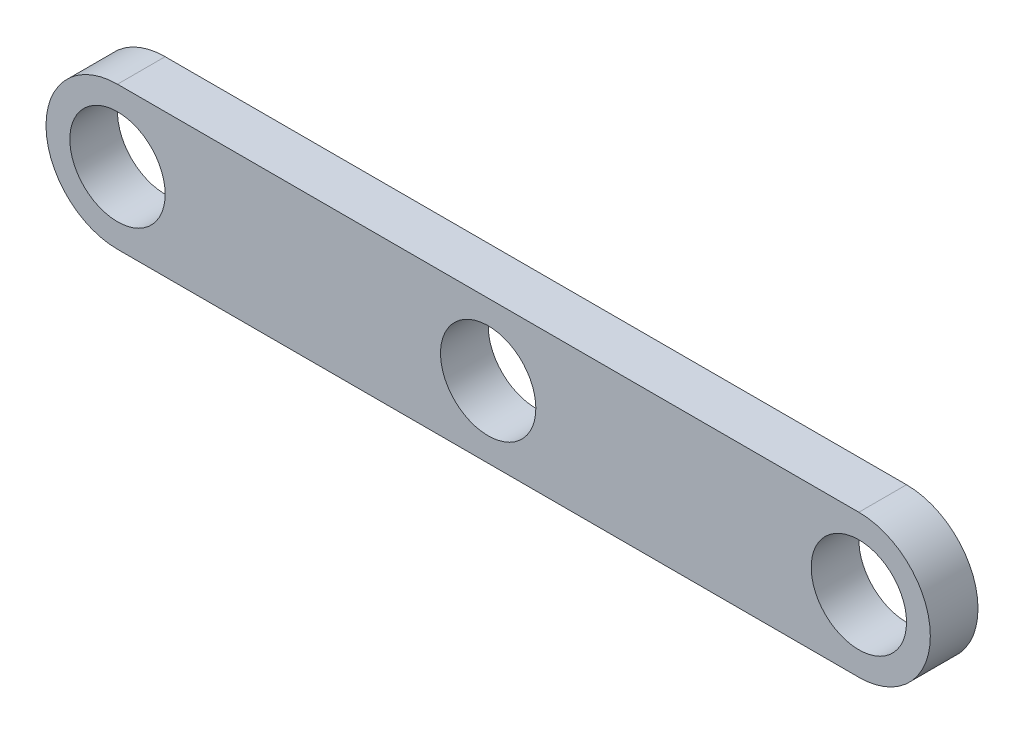
from build123d import *

# Parameters (mm, degrees)
SKETCH1_R           = 10
BOSS_EXTRUDE1_DEPTH = 10


with BuildPart() as part:
    # Sketch1 → Boss-Extrude1 (new body)
    with BuildSketch(Plane.XY):
        with BuildLine():
            Line((-77.778184123, 15), (77.778184123, 15))
            ThreePointArc((77.778184123, 15), (92.778184123, 0), (77.778184123, -15))
            Line((77.778184123, -15), (-77.778184123, -15))
            ThreePointArc((-77.778184123, -15), (-92.778184123, 0), (-77.778184123, 15))
        make_face()
        with Locations((-77.778184123, 0)):
            Circle(SKETCH1_R, mode=Mode.SUBTRACT)
        with Locations((77.778184123, 0)):
            Circle(SKETCH1_R, mode=Mode.SUBTRACT)
        Circle(SKETCH1_R, mode=Mode.SUBTRACT)
    extrude(amount=BOSS_EXTRUDE1_DEPTH)


solid = part.part
